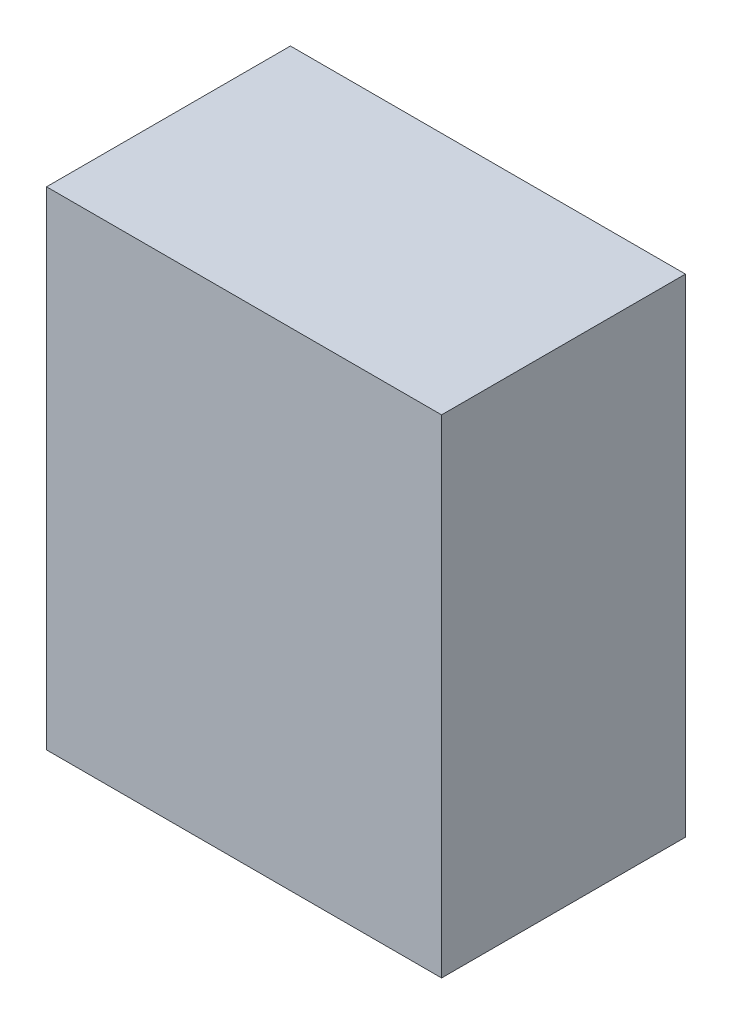
from build123d import *

# Parameters (mm, degrees)
SKETCH1_W           = 16.2
SKETCH1_H           = 20
BOSS_EXTRUDE1_DEPTH = 10


with BuildPart() as part:
    # Sketch1 → Boss-Extrude1 (new body)
    with BuildSketch(Plane.XY):
        with Locations((8.1, 10)):
            Rectangle(SKETCH1_W, SKETCH1_H)
    extrude(amount=BOSS_EXTRUDE1_DEPTH)


solid = part.part
